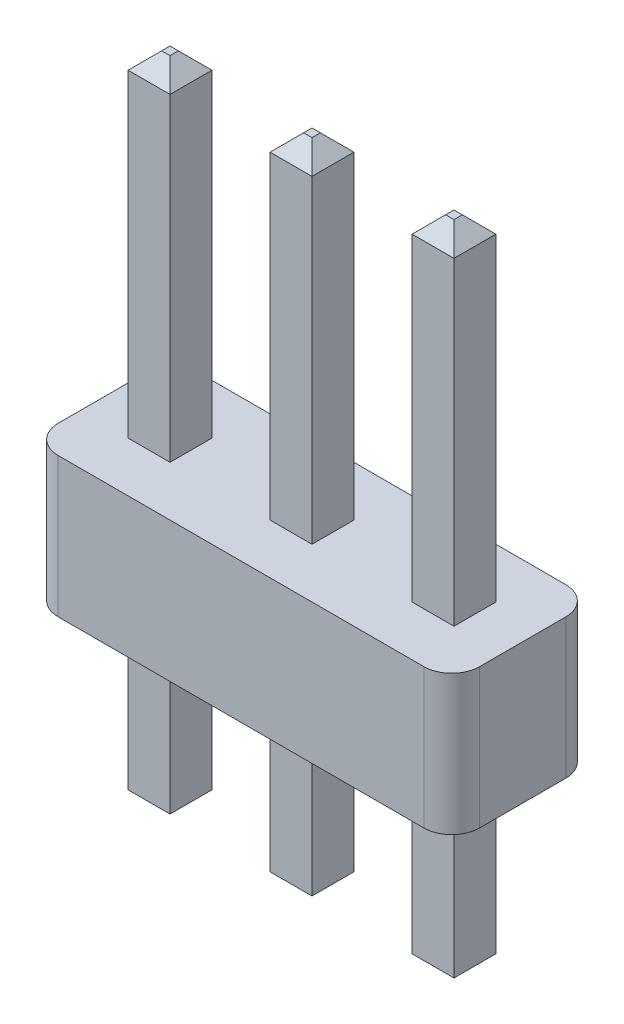
from build123d import *

# Parameters (mm, degrees)
BOSS_EXTRUDE1_DEPTH      = 2.5
BOSS_EXTRUDE2_DEPTH      = 8.5
BOSS_EXTRUDE2_DEPTH_BACK = 3.25
SKETCH2_W                = 0.75
SKETCH2_H                = 0.75
CHAMFER1_SIZE            = 0.3


with BuildPart() as part:
    # Sketch1 → Boss-Extrude1 (new body)
    with BuildSketch(Plane(origin=(0, 0, 0), x_dir=(-1, 0, 0), z_dir=(0, 1, 0))):
        with BuildLine():
            Line((-3.27, 1.27), (3.27, 1.27))
            ThreePointArc((3.27, 1.27), (3.623553391, 1.123553391), (3.77, 0.77))
            Line((3.77, 0.77), (3.77, -0.77))
            ThreePointArc((3.77, -0.77), (3.623553391, -1.123553391), (3.27, -1.27))
            Line((3.27, -1.27), (-3.27, -1.27))
            ThreePointArc((-3.27, -1.27), (-3.623553391, -1.123553391), (-3.77, -0.77))
            Line((-3.77, -0.77), (-3.77, 0.77))
            ThreePointArc((-3.77, 0.77), (-3.623553391, 1.123553391), (-3.27, 1.27))
        make_face()
    extrude(amount=BOSS_EXTRUDE1_DEPTH)

    # Sketch2 → Boss-Extrude2 (add, two sides: drawn at the far end of the back side and taken through both)
    with BuildSketch(Plane(origin=(0, 0, 0), x_dir=(-1, 0, 0), z_dir=(0, 1, 0)).offset(-BOSS_EXTRUDE2_DEPTH_BACK)):
        with Locations((2.54, 0)):
            Rectangle(SKETCH2_W, SKETCH2_H)
        Rectangle(SKETCH2_W, SKETCH2_H)
        with Locations((-2.54, 0)):
            Rectangle(SKETCH2_W, SKETCH2_H)
    extrude(amount=BOSS_EXTRUDE2_DEPTH + BOSS_EXTRUDE2_DEPTH_BACK)

    # Chamfer1
    chamfer1_edges = [part.edges().sort_by_distance(p)[0] for p in [
        (-2.165, -3.25, 0),
        (-2.54, -3.25, 0.375),
        (-2.915, -3.25, 0),
        (-2.54, -3.25, -0.375),
        (-2.165, 8.5, 0),
        (-2.54, 8.5, -0.375),
        (-2.915, 8.5, 0),
        (-2.54, 8.5, 0.375),
        (-0.375, -3.25, 0),
        (0, -3.25, -0.375),
        (0.375, -3.25, 0),
        (0, -3.25, 0.375),
        (-0.375, 8.5, 0),
        (0, 8.5, 0.375),
        (0.375, 8.5, 0),
        (0, 8.5, -0.375),
        (2.165, -3.25, 0),
        (2.54, -3.25, -0.375),
        (2.915, -3.25, 0),
        (2.54, -3.25, 0.375),
        (2.165, 8.5, 0),
        (2.54, 8.5, 0.375),
        (2.915, 8.5, 0),
        (2.54, 8.5, -0.375),
    ]]
    chamfer(chamfer1_edges, length=CHAMFER1_SIZE)


solid = part.part
